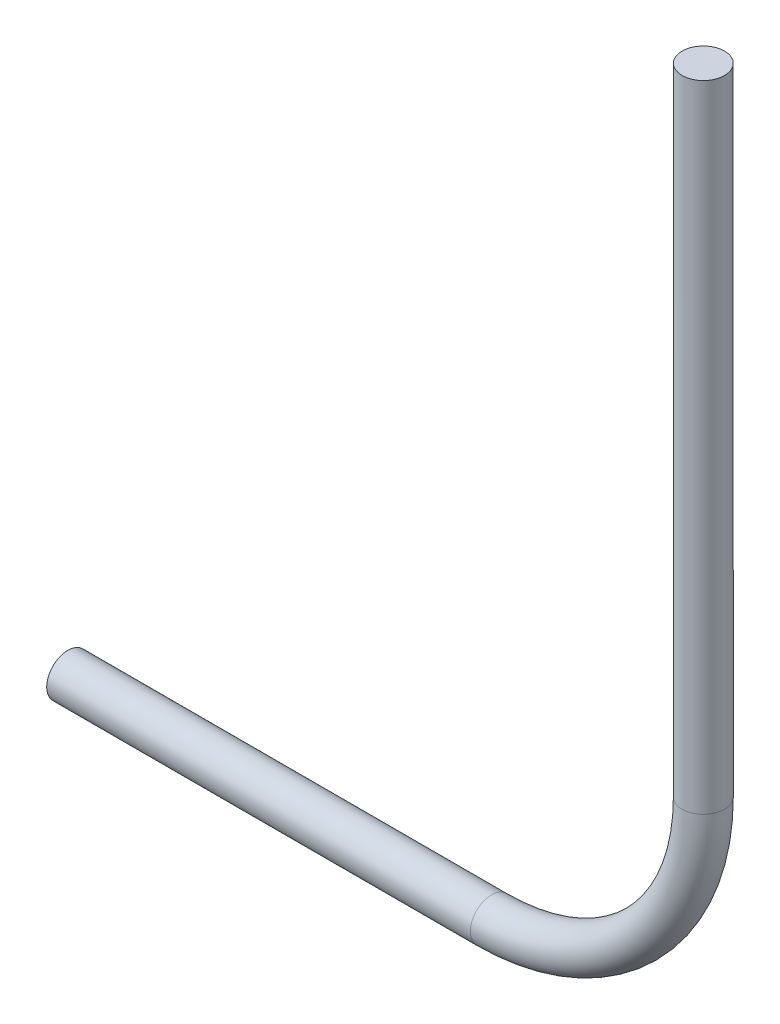
from build123d import *

# Parameters (mm, degrees)
SKETCH_4_R = 1


with BuildPart() as part:
    # ｽｲｰﾌﾟ1: sweep along a path in ｽｹｯﾁ1
    with BuildLine(Plane.XY) as sweep_1_path:
        Line((0, 0), (20, 0))
        ThreePointArc((20, 0), (27.071067812, 2.928932188), (30, 10))
        Line((30, 10), (30, 40))
    # ｽｹｯﾁ4 → ｽｲｰﾌﾟ1 (sweep)
    with BuildSketch(Plane(origin=(0, 0, 0), x_dir=(0, 0, -1), z_dir=(1, 0, 0))):
        Circle(SKETCH_4_R)
    sweep(path=sweep_1_path.line)


solid = part.part
